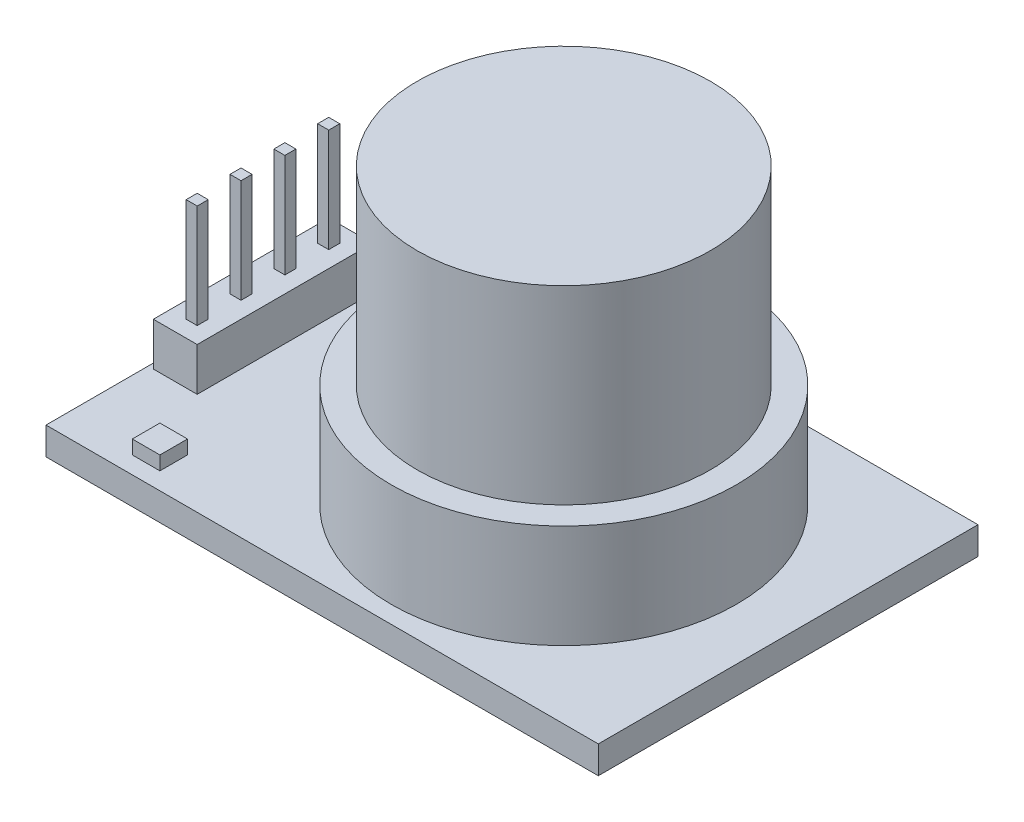
from build123d import *

# Parameters (mm, degrees)
SK_PCB_W            = 32
SK_PCB_H            = 22
PCB_DEPTH           = 1.6
SENSOR_START        = 1.6
SK_SENSOR_BASE_R    = 10
SENSOR_BASE_DEPTH   = 6
SENSOR_START_2      = 7.6
SK_SENSOR_MESH_R    = 8.5
SENSOR_MESH_DEPTH   = 11
HEADER_START        = 1.6
SK_HEADER_4_PIN_W   = 2.54
SK_HEADER_4_PIN_H   = 10.16
HEADER_4_PIN_DEPTH  = 2.5
HEADER_START_2      = 4.1
SK_HEADER_PINS_W    = 0.64
SK_HEADER_PINS_H    = 0.64
HEADER_PINS_DEPTH   = 6
HEADER_PINS_2_DEPTH = 6
HEADER_PINS_3_DEPTH = 6
HEADER_PINS_4_DEPTH = 6
LEDS_START          = 1.6
SK_LEDS_W           = 1.6
SK_LEDS_H           = 1.6
LEDS_DEPTH          = 0.8
LEDS_2_DEPTH        = 0.8


with BuildPart() as part:
    # SK PCB → PCB (new body)
    with BuildSketch(Plane(origin=(0, 0, 0), x_dir=(1, 0, 0), z_dir=(0, 1, 0))):
        with Locations((16, 11)):
            Rectangle(SK_PCB_W, SK_PCB_H)
    extrude(amount=PCB_DEPTH)


with BuildPart() as body_2:
    # SK Sensor base → Sensor base (new body)
    with BuildSketch(Plane(origin=(0, 0, 0), x_dir=(1, 0, 0), z_dir=(0, 1, 0)).offset(SENSOR_START)):
        with Locations(Location((19, 11, 0), (0, 0, 270))):
            Circle(SK_SENSOR_BASE_R)
    extrude(amount=SENSOR_BASE_DEPTH)


with BuildPart() as body_3:
    # SK Sensor mesh → Sensor mesh (new body)
    with BuildSketch(Plane(origin=(0, 0, 0), x_dir=(1, 0, 0), z_dir=(0, 1, 0)).offset(SENSOR_START_2)):
        with Locations(Location((19, 11, 0), (0, 0, 270))):
            Circle(SK_SENSOR_MESH_R)
    extrude(amount=SENSOR_MESH_DEPTH)


with BuildPart() as body_4:
    # SK Header 4 pin → Header 4 pin (new body)
    with BuildSketch(Plane(origin=(0, 0, 0), x_dir=(1, 0, 0), z_dir=(0, 1, 0)).offset(HEADER_START)):
        with Locations((1.57, 11)):
            Rectangle(SK_HEADER_4_PIN_W, SK_HEADER_4_PIN_H)
    extrude(amount=HEADER_4_PIN_DEPTH)


with BuildPart() as body_5:
    # SK Header pins → Header pins (new body)
    with BuildSketch(Plane(origin=(0, 0, 0), x_dir=(1, 0, 0), z_dir=(0, 1, 0)).offset(HEADER_START_2)):
        with Locations((1.57, 14.81)):
            Rectangle(SK_HEADER_PINS_W, SK_HEADER_PINS_H)
    extrude(amount=HEADER_PINS_DEPTH)


with BuildPart() as body_6:
    # SK Header pins → Header pins 2 (new body)
    with BuildSketch(Plane(origin=(0, 0, 0), x_dir=(1, 0, 0), z_dir=(0, 1, 0)).offset(HEADER_START_2)):
        with Locations((1.57, 12.27)):
            Rectangle(SK_HEADER_PINS_W, SK_HEADER_PINS_H)
    extrude(amount=HEADER_PINS_2_DEPTH)


with BuildPart() as body_7:
    # SK Header pins → Header pins 3 (new body)
    with BuildSketch(Plane(origin=(0, 0, 0), x_dir=(1, 0, 0), z_dir=(0, 1, 0)).offset(HEADER_START_2)):
        with Locations((1.57, 9.73)):
            Rectangle(SK_HEADER_PINS_W, SK_HEADER_PINS_H)
    extrude(amount=HEADER_PINS_3_DEPTH)


with BuildPart() as body_8:
    # SK Header pins → Header pins 4 (new body)
    with BuildSketch(Plane(origin=(0, 0, 0), x_dir=(1, 0, 0), z_dir=(0, 1, 0)).offset(HEADER_START_2)):
        with Locations((1.57, 7.19)):
            Rectangle(SK_HEADER_PINS_W, SK_HEADER_PINS_H)
    extrude(amount=HEADER_PINS_4_DEPTH)


with BuildPart() as body_9:
    # SK LEDs → LEDs (new body)
    with BuildSketch(Plane(origin=(0, 0, 0), x_dir=(1, 0, 0), z_dir=(0, 1, 0)).offset(LEDS_START)):
        with Locations((4.8, 20.2)):
            Rectangle(SK_LEDS_W, SK_LEDS_H)
    extrude(amount=LEDS_DEPTH)


with BuildPart() as body_10:
    # SK LEDs → LEDs 2 (new body)
    with BuildSketch(Plane(origin=(0, 0, 0), x_dir=(1, 0, 0), z_dir=(0, 1, 0)).offset(LEDS_START)):
        with Locations((4.8, 1.8)):
            Rectangle(SK_LEDS_W, SK_LEDS_H)
    extrude(amount=LEDS_2_DEPTH)


solid = Compound([part.part, body_2.part, body_3.part, body_4.part, body_5.part, body_6.part, body_7.part, body_8.part, body_9.part, body_10.part])
